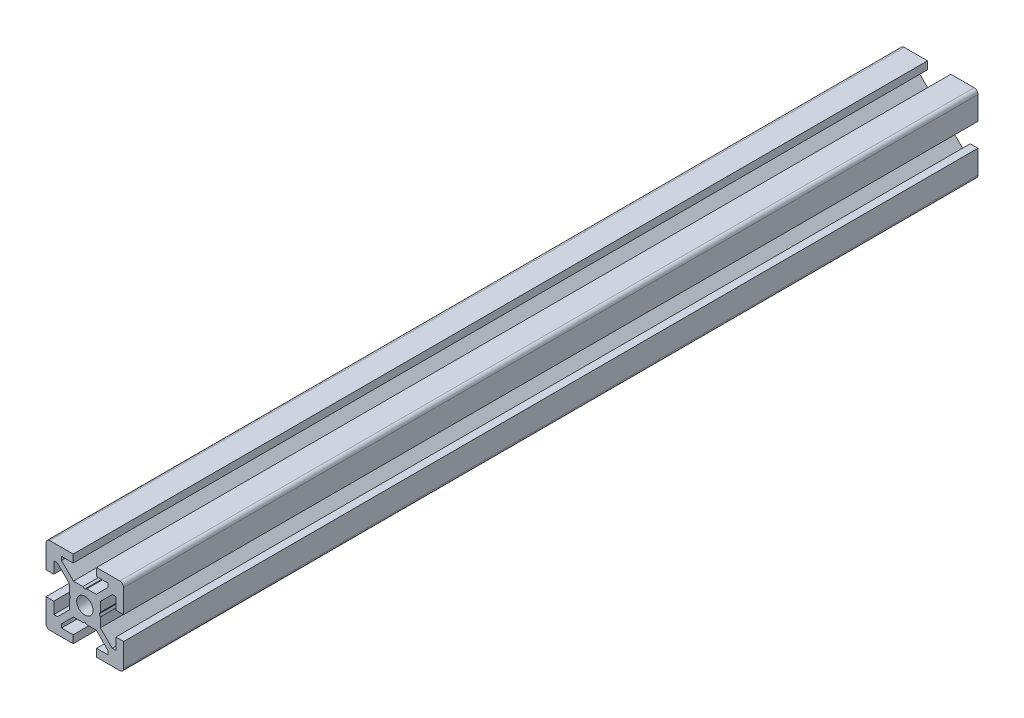
from build123d import *

# Parameters (mm, degrees)
MODEL_R         = 2.1
EXTRUDE_1_DEPTH = 220


with BuildPart() as part:
    # Model → 보스-돌출1 (new body)
    with BuildSketch(Plane.XY):
        with BuildLine():
            Line((-10, 3), (-8, 3))
            Line((-8, 3), (-8, 6))
            Line((-8, 6), (-7.060660172, 6))
            Line((-7.060660172, 6), (-4, 2.939339828))
            Line((-4, 2.939339828), (-4, 0.519615242))
            Line((-4, 0.519615242), (-3.7, 0))
            Line((-3.7, 0), (-4, -0.519615242))
            Line((-4, -0.519615242), (-4, -2.939339828))
            Line((-4, -2.939339828), (-7.060660172, -6))
            Line((-7.060660172, -6), (-8, -6))
            Line((-8, -6), (-8, -3))
            Line((-8, -3), (-10, -3))
            Line((-10, -3), (-10, -9))
            ThreePointArc((-10, -9), (-9.707106781, -9.707106781), (-9, -10))
            Line((-9, -10), (-3, -10))
            Line((-3, -10), (-3, -8))
            Line((-3, -8), (-6, -8))
            Line((-6, -8), (-6, -7.060660172))
            Line((-6, -7.060660172), (-2.939339828, -4))
            Line((-2.939339828, -4), (-0.519615242, -4))
            Line((-0.519615242, -4), (0, -3.7))
            Line((0, -3.7), (0.519615242, -4))
            Line((0.519615242, -4), (2.939339828, -4))
            Line((2.939339828, -4), (6, -7.060660172))
            Line((6, -7.060660172), (6, -8))
            Line((6, -8), (3, -8))
            Line((3, -8), (3, -10))
            Line((3, -10), (9, -10))
            ThreePointArc((9, -10), (9.707106781, -9.707106781), (10, -9))
            Line((10, -9), (10, -3))
            Line((10, -3), (8, -3))
            Line((8, -3), (8, -6))
            Line((8, -6), (7.060660172, -6))
            Line((7.060660172, -6), (4, -2.939339828))
            Line((4, -2.939339828), (4, -0.519615242))
            Line((4, -0.519615242), (3.7, 0))
            Line((3.7, 0), (4, 0.519615242))
            Line((4, 0.519615242), (4, 2.939339828))
            Line((4, 2.939339828), (7.060660172, 6))
            Line((7.060660172, 6), (8, 6))
            Line((8, 6), (8, 3))
            Line((8, 3), (10, 3))
            Line((10, 3), (10, 9))
            ThreePointArc((10, 9), (9.707106781, 9.707106781), (9, 10))
            Line((9, 10), (3, 10))
            Line((3, 10), (3, 8))
            Line((3, 8), (6, 8))
            Line((6, 8), (6, 7.060660172))
            Line((6, 7.060660172), (2.939339828, 4))
            Line((2.939339828, 4), (0.519615242, 4))
            Line((0.519615242, 4), (0, 3.7))
            Line((0, 3.7), (-0.519615242, 4))
            Line((-0.519615242, 4), (-2.939339828, 4))
            Line((-2.939339828, 4), (-6, 7.060660172))
            Line((-6, 7.060660172), (-6, 8))
            Line((-6, 8), (-3, 8))
            Line((-3, 8), (-3, 10))
            Line((-3, 10), (-9, 10))
            ThreePointArc((-9, 10), (-9.707106781, 9.707106781), (-10, 9))
            Line((-10, 9), (-10, 3))
        make_face()
        Circle(MODEL_R, mode=Mode.SUBTRACT)
    extrude(amount=EXTRUDE_1_DEPTH)


solid = part.part
